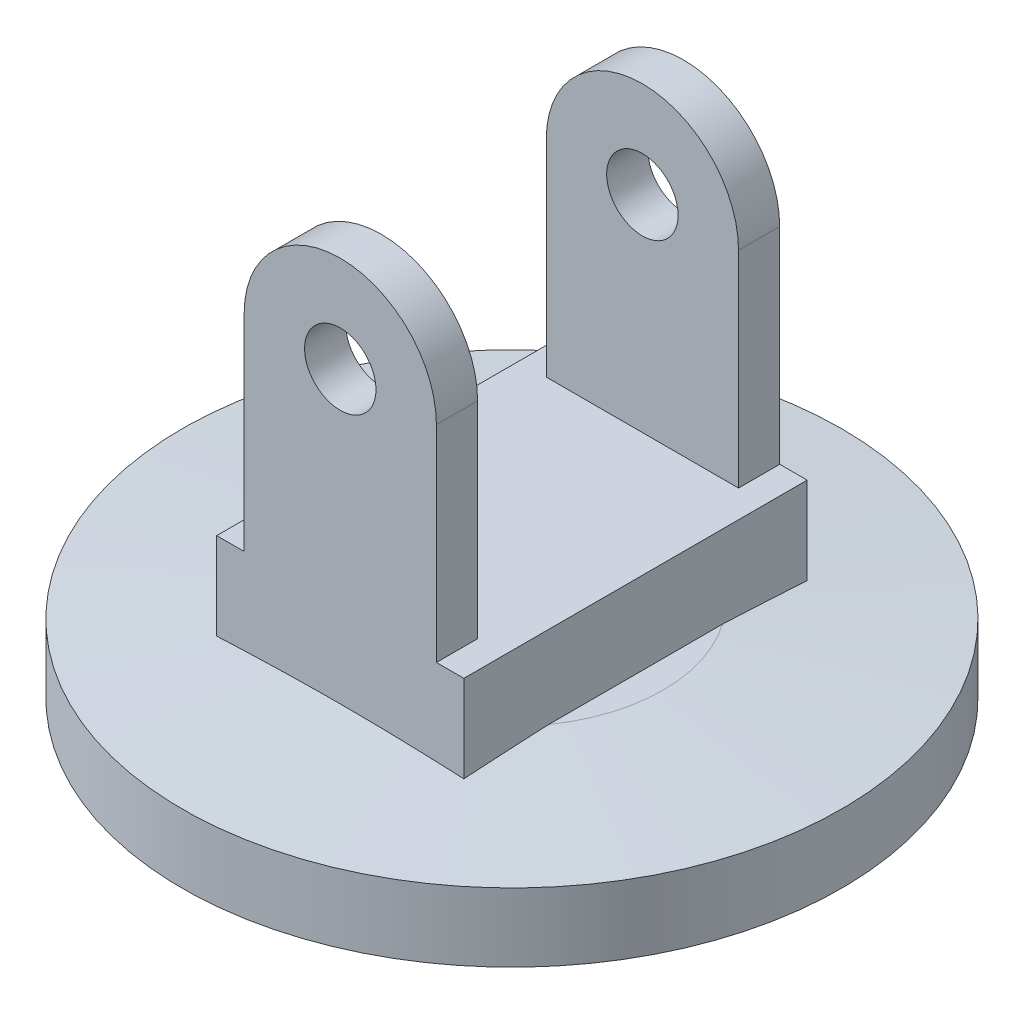
from build123d import *

# Parameters (mm, degrees)
OREJA_ANTERIOR_DEPTH         = 3
OREJA_POSTERIOR_DEPTH        = 3
SKETCH3_W                    = 18
SKETCH3_H                    = 8
PUENTE_DEPTH                 = 25
SKETCH5_R                    = 2.6
AGUJERO_EJE_DESVIACION_DEPTH = 1000


with BuildPart() as part:
    # Sketch1 → Oreja_anterior (new body)
    with BuildSketch(Plane.XY.offset(-12.5)):
        with BuildLine():
            Line((7, 0), (7, -16))
            ThreePointArc((7, -16), (0, -23), (-7, -16))
            Line((-7, -16), (-7, 0))
            ThreePointArc((-7, 0), (0, 7), (7, 0))
        make_face()
    extrude(amount=OREJA_ANTERIOR_DEPTH)



with BuildPart() as body_2:
    # Sketch2 → Oreja_posterior (new body)
    with BuildSketch(Plane.XY.offset(9.5)):
        with BuildLine():
            Line((7, 0), (7, -16))
            ThreePointArc((7, -16), (0, -23), (-7, -16))
            Line((-7, -16), (-7, 0))
            ThreePointArc((-7, 0), (0, 7), (7, 0))
        make_face()
    extrude(amount=OREJA_POSTERIOR_DEPTH)


with BuildPart() as part_1:
    add(part.part)

    add(body_2.part)  # Puente merges body 2
    # Sketch3 → Puente (add)
    with BuildSketch(Plane.XY.offset(-12.5)):
        with Locations((0, -19)):
            Rectangle(SKETCH3_W, SKETCH3_H)
    extrude(amount=PUENTE_DEPTH)

    # Sketch4 → Brida_mano (revolve)
    with BuildSketch(Plane.XY, mode=Mode.PRIVATE) as brida_mano_sk:
        Polygon((0, -21), (11, -21), (24, -22), (24, -27), (11, -27), (0, -27), align=None)
    revolve(brida_mano_sk.sketch.rotate(Axis((0, -31, 0), (0, 1, 0)), 90), axis=Axis((0, -31, 0), (0, 1, 0)))

    # Sketch5 → Agujero_eje_desviacion (cut, symmetric)
    with BuildSketch(Plane.XY):
        Circle(SKETCH5_R)
    extrude(amount=AGUJERO_EJE_DESVIACION_DEPTH, both=True, mode=Mode.SUBTRACT)


solid = part_1.part
